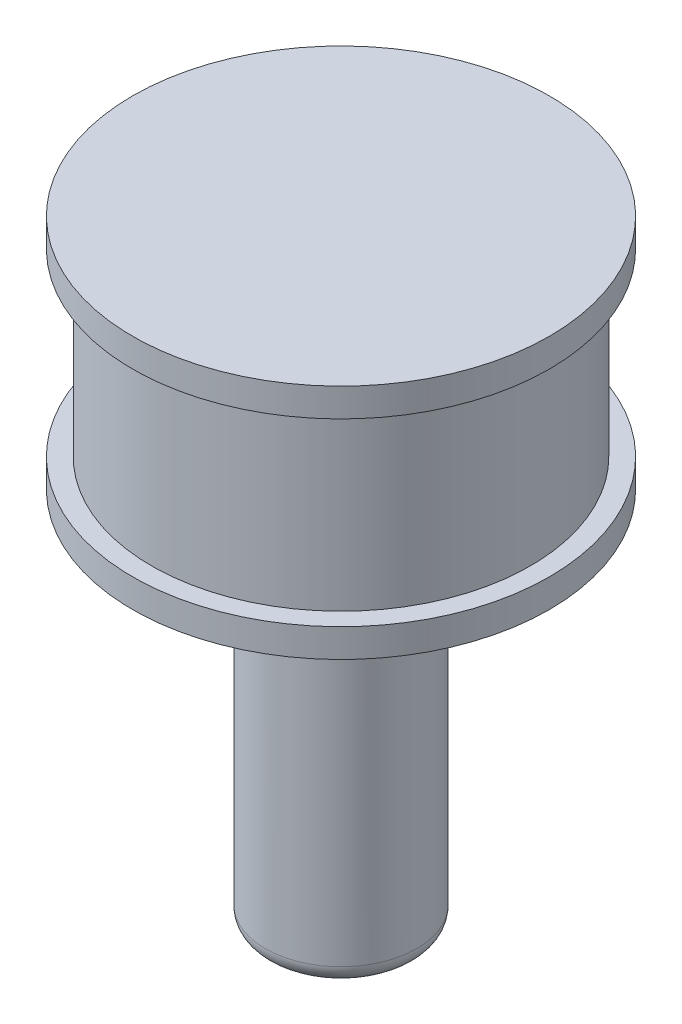
from build123d import *

# Parameters (mm, degrees)
FILLET1_R = 1


with BuildPart() as part:
    # Sketch1 → Revolve1 (revolve)
    with BuildSketch(Plane.XY):
        Polygon((-4, -20), (-4, 0), (-11, 0), (-11, 1.5), (-10, 1.5), (-10, 11), (-11, 11), (-11, 12.5), (0, 12.5), (0, -20), align=None)
    revolve(axis=Axis((0, 12.5, 0), (0, -1, 0)))

    # Fillet1
    fillet1_edges = [part.edges().sort_by_distance(p)[0] for p in [
        (4, -20, 0),
    ]]
    fillet(fillet1_edges, radius=FILLET1_R)


solid = part.part
